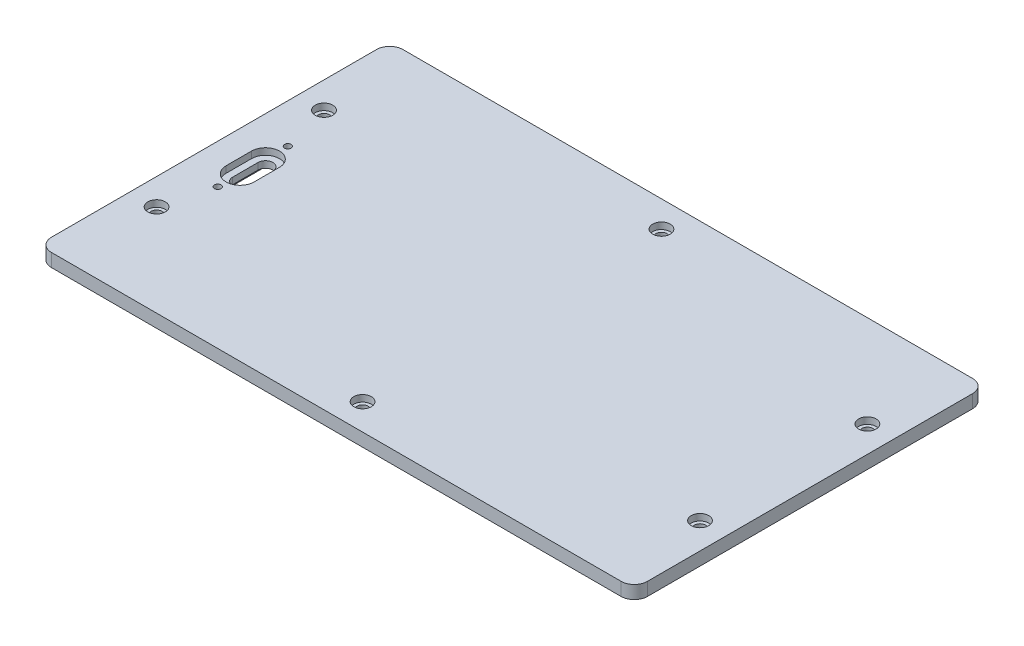
from build123d import *

# Parameters (mm, degrees)
BOSS_EXTRUDE2_DEPTH      = 3
BOSS_EXTRUDE3_DEPTH      = 2
BOSS_EXTRUDE3_DEPTH_BACK = 3
CUT_EXTRUDE1_DEPTH       = 80.000063291
CUT_EXTRUDE1_DEPTH_BACK  = 80.000063291
SKETCH8_R                = 1.25
SKETCH9_W                = 7
SKETCH9_H                = 20.5
CUT_EXTRUDE2_DEPTH       = 2
SKETCH10_R               = 0.75
CUT_EXTRUDE3_DEPTH       = 80.000063291
SKETCH11_R               = 3.5
CUT_EXTRUDE4_DEPTH       = 2
SKETCH12_R               = 1.25
CUT_EXTRUDE6_DEPTH       = 80.101264212
CUT_EXTRUDE7_DEPTH       = 1.5
SKETCH19_R               = 2
CUT_EXTRUDE9_DEPTH       = 1.5


with BuildPart() as part:
    # Sketch1 → Boss-Extrude2 (new body)
    with BuildSketch(Plane(origin=(0, 0, 0), x_dir=(1, 0, 0), z_dir=(0, 1, 0))):
        with BuildLine():
            Line((65, 40.1), (-65, 40.1))
            ThreePointArc((-65, 40.1), (-67.121320344, 39.221320344), (-68, 37.1))
            Line((-68, 37.1), (-68, -37.1))
            ThreePointArc((-68, -37.1), (-67.121320344, -39.221320344), (-65, -40.1))
            Line((-65, -40.1), (65, -40.1))
            ThreePointArc((65, -40.1), (67.121320344, -39.221320344), (68, -37.1))
            Line((68, -37.1), (68, 37.1))
            ThreePointArc((68, 37.1), (67.121320344, 39.221320344), (65, 40.1))
        make_face()
        with BuildLine():
            Line((65, -34.1), (65, 34.1))
            ThreePointArc((65, 34.1), (64.121320344, 36.221320344), (62, 37.1))
            Line((62, 37.1), (-62, 37.1))
            ThreePointArc((-62, 37.1), (-64.121320344, 36.221320344), (-65, 34.1))
            Line((-65, 34.1), (-65, -34.1))
            ThreePointArc((-65, -34.1), (-64.121320344, -36.221320344), (-62, -37.1))
            Line((-62, -37.1), (62, -37.1))
            ThreePointArc((62, -37.1), (64.121320344, -36.221320344), (65, -34.1))
        make_face(mode=Mode.SUBTRACT)
    extrude(amount=BOSS_EXTRUDE2_DEPTH)

    # Sketch7 → Boss-Extrude3 (add, two sides: drawn at the far end of the back side and taken through both)
    with BuildSketch(Plane.XZ.offset(-BOSS_EXTRUDE3_DEPTH_BACK)):
        with BuildLine():
            Line((-62, 37.1), (62, 37.1))
            ThreePointArc((62, 37.1), (64.121320344, 36.221320344), (65, 34.1))
            Line((65, 34.1), (65, -34.1))
            ThreePointArc((65, -34.1), (64.121320344, -36.221320344), (62, -37.1))
            Line((62, -37.1), (-62, -37.1))
            ThreePointArc((-62, -37.1), (-64.121320344, -36.221320344), (-65, -34.1))
            Line((-65, -34.1), (-65, 34.1))
            ThreePointArc((-65, 34.1), (-64.121320344, 36.221320344), (-62, 37.1))
        make_face()
    extrude(amount=BOSS_EXTRUDE3_DEPTH + BOSS_EXTRUDE3_DEPTH_BACK)

    # Sketch8 → Cut-Extrude1 (cut, two sides: drawn at the far end of the back side and taken through both)
    with BuildSketch(Plane(origin=(0, 0, 0), x_dir=(1, 0, 0), z_dir=(0, 1, 0)).offset(-CUT_EXTRUDE1_DEPTH_BACK)):
        with Locations((62, 19.1)):
            Circle(SKETCH8_R)
        with Locations((62, -19.1)):
            Circle(SKETCH8_R)
        with Locations((-62, -19.1)):
            Circle(SKETCH8_R)
        with Locations((-62, 19.1)):
            Circle(SKETCH8_R)
    extrude(amount=CUT_EXTRUDE1_DEPTH + CUT_EXTRUDE1_DEPTH_BACK, mode=Mode.SUBTRACT)

    # Sketch9 → Cut-Extrude2 (cut)
    with BuildSketch(Plane.XZ.offset(2)):
        with Locations((-59, 0.15)):
            Rectangle(SKETCH9_W, SKETCH9_H)
    extrude(amount=-CUT_EXTRUDE2_DEPTH, mode=Mode.SUBTRACT)

    # Sketch10 → Cut-Extrude3 (cut, through all)
    with BuildSketch(Plane.XZ):
        with Locations((-59, -7.85)):
            Circle(SKETCH10_R)
        with Locations((-59, 8.15)):
            Circle(SKETCH10_R)
        with BuildLine():
            Line((-60.7, -2.75), (-60.7, 3.05))
            ThreePointArc((-60.7, 3.05), (-59, 4.75), (-57.3, 3.05))
            Line((-57.3, 3.05), (-57.3, -2.75))
            ThreePointArc((-57.3, -2.75), (-59, -4.45), (-60.7, -2.75))
        make_face()
    extrude(amount=-CUT_EXTRUDE3_DEPTH, mode=Mode.SUBTRACT)

    # Sketch11 → Cut-Extrude4 (cut)
    with BuildSketch(Plane.XZ.offset(2)):
        with Locations((-59, 10.4)):
            Circle(SKETCH11_R)
        with Locations((-59, -10.1)):
            Circle(SKETCH11_R)
    extrude(amount=-CUT_EXTRUDE4_DEPTH, mode=Mode.SUBTRACT)

    # Sketch12 → Cut-Extrude6 (cut, through all)
    with BuildSketch(Plane.XZ.offset(2)):
        with Locations((0, 34.1)):
            Circle(SKETCH12_R)
        with Locations((0, -34.1)):
            Circle(SKETCH12_R)
    extrude(amount=-CUT_EXTRUDE6_DEPTH, mode=Mode.SUBTRACT)

    # Sketch14 → Cut-Extrude7 (cut)
    with BuildSketch(Plane(origin=(0, 3, 0), x_dir=(1, 0, 0), z_dir=(0, 1, 0))):
        with BuildLine():
            Line((-62.2, 2.75), (-62.2, -3.05))
            ThreePointArc((-62.2, -3.05), (-59, -6.25), (-55.8, -3.05))
            Line((-55.8, -3.05), (-55.8, 2.75))
            ThreePointArc((-55.8, 2.75), (-59, 5.95), (-62.2, 2.75))
        make_face()
    extrude(amount=-CUT_EXTRUDE7_DEPTH, mode=Mode.SUBTRACT)

    # Sketch19 → Cut-Extrude9 (cut)
    with BuildSketch(Plane(origin=(0, 3, 0), x_dir=(1, 0, 0), z_dir=(0, 1, 0))):
        with Locations((-62, -19.1)):
            Circle(SKETCH19_R)
        with Locations((-62, 19.1)):
            Circle(SKETCH19_R)
        with Locations((0, 34.1)):
            Circle(SKETCH19_R)
        with Locations((0, -34.1)):
            Circle(SKETCH19_R)
        with Locations((62, -19.1)):
            Circle(SKETCH19_R)
        with Locations((62, 19.1)):
            Circle(SKETCH19_R)
    extrude(amount=-CUT_EXTRUDE9_DEPTH, mode=Mode.SUBTRACT)


solid = part.part
